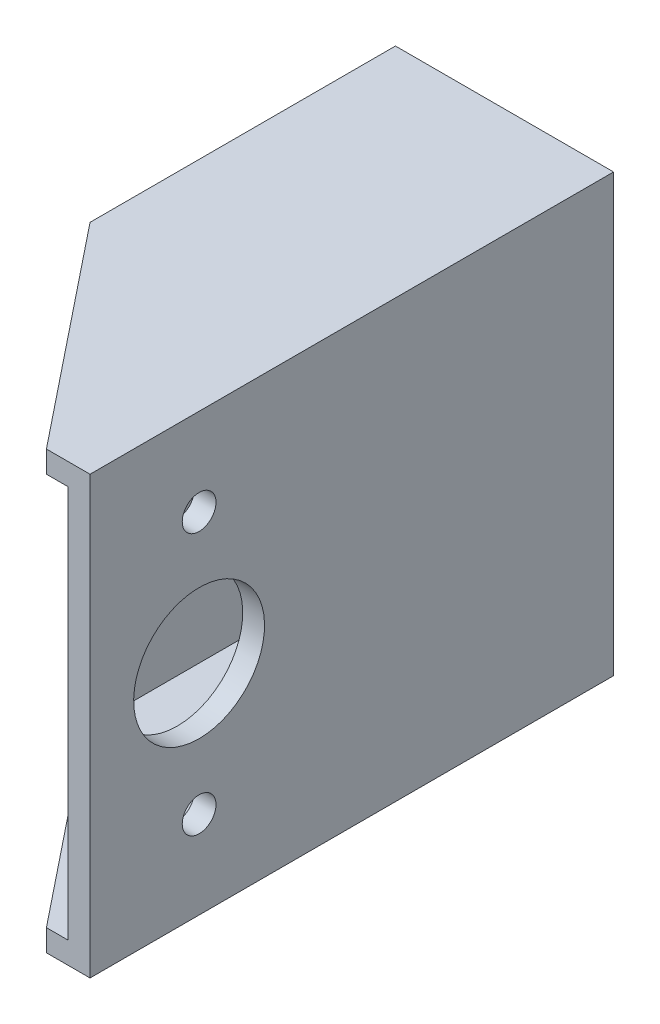
from build123d import *

# Parameters (mm, degrees)
SKETCH1_W                    = 31.75
SKETCH1_H                    = 63.5
SKETCH1_W_2                  = 25.4
SKETCH1_H_2                  = 57.15
BOSS_EXTRUDE1_DEPTH          = 76.2
CUT_EXTRUDE1_REACH           = 103.105
SKETCH3_R                    = 9.525
CUT_EXTRUDE2_DEPTH           = 3.175
F_10_0_1935_DIAMETER_HOLE1_D = 4.9149


with BuildPart() as part:
    # Sketch1 → Boss-Extrude1 (new body)
    with BuildSketch(Plane.XY):
        with Locations((3.710272719, -29.23968021)):
            Rectangle(SKETCH1_W, SKETCH1_H)
        with Locations((3.710272719, -29.23968021)):
            Rectangle(SKETCH1_W_2, SKETCH1_H_2, mode=Mode.SUBTRACT)
    extrude(amount=BOSS_EXTRUDE1_DEPTH)

    # Cut-Extrude1: up to this face of the body (flat: up to its plane)
    cut_extrude1_end = Plane(part.part.faces().sort_by_distance((3.710272719, -60.98968021, 38.1))[0])
    # Sketch2 → Cut-Extrude1 (cut, up to the picked face)
    with BuildSketch(Plane(origin=(0, 2.51031979, 0), x_dir=(1, 0, 0), z_dir=(0, 1, 0)), mode=Mode.PRIVATE) as cut_extrude1_sk1:
        Polygon((-12.164727281, -76.2), (13.235272719, -76.2), (-12.164727281, -44.45), align=None)
    cut_extrude1_tool1 = split(extrude(cut_extrude1_sk1.sketch, amount=-CUT_EXTRUDE1_REACH, mode=Mode.PRIVATE), bisect_by=cut_extrude1_end, keep=Keep.BOTH, mode=Mode.PRIVATE)
    add(cut_extrude1_tool1.solids().sort_by(Axis((-3.698061, 2.51032, 65.616667), (0, -1, 0)))[0], mode=Mode.SUBTRACT)

    # Sketch3 → Cut-Extrude2 (cut)
    with BuildSketch(Plane.ZY.offset(-16.410272719)):
        with Locations(Location((60.325, -29.23968021, 0), (0, 0, 270))):
            Circle(SKETCH3_R)
    extrude(amount=-CUT_EXTRUDE2_DEPTH, mode=Mode.SUBTRACT)

    # #10 (0.1935) Diameter Hole1 (through all)
    with Locations(Plane(origin=(16.410272719, -48.28968021, 60.325), x_dir=(0, -1, 0), z_dir=(-1, 0, 0))):
        with Locations((0, 0), (-38.1, 0)):
            Hole(F_10_0_1935_DIAMETER_HOLE1_D / 2)


solid = part.part
